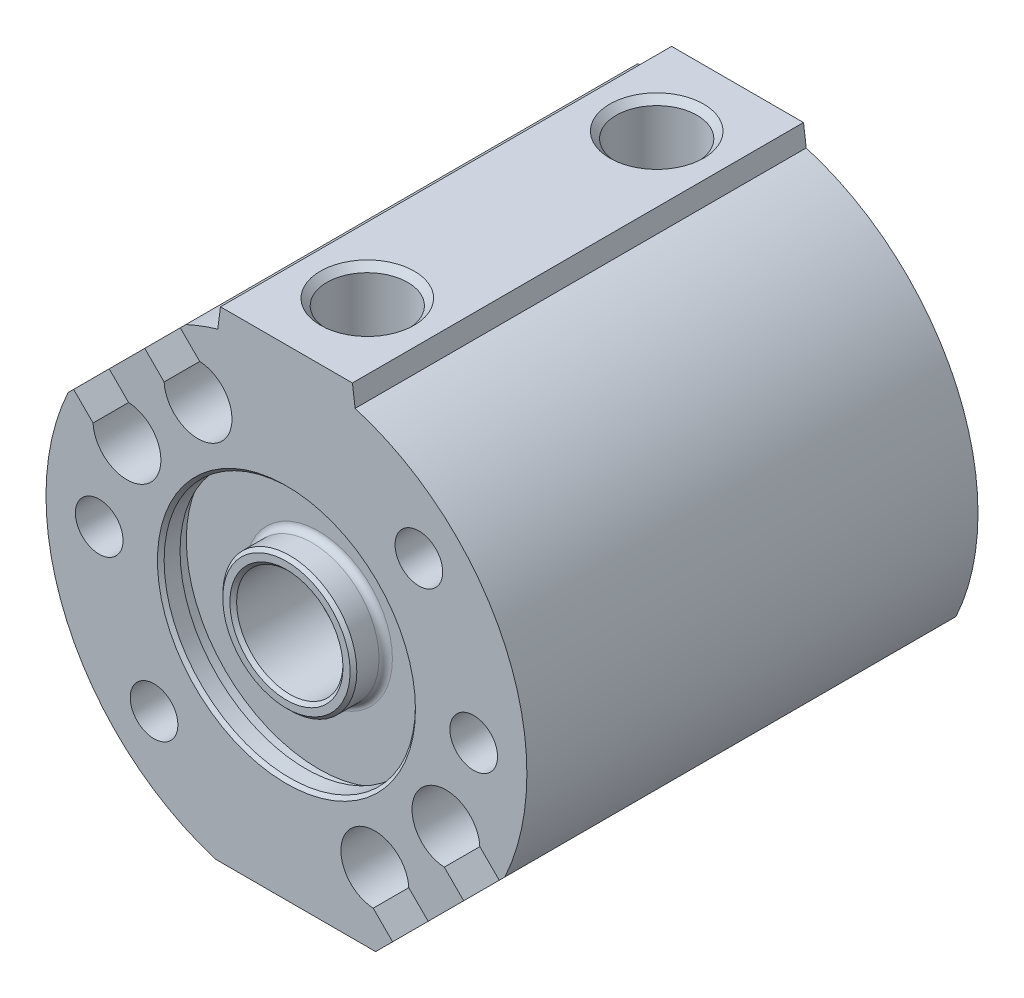
from build123d import *

# Parameters (mm, degrees)
EXTRUDE1_DEPTH                       = 13.462
EXTRUDE1_DEPTH_BACK                  = 13.462
SKETCH1_W                            = 28.702
SKETCH1_H                            = 28.702
SKETCH2_R                            = 20.295378834
F_056_BODY_DEPTH                     = 34.716526778
F_056_250_NOSE_CHAMFER_R             = 0.4
F_056_PORT_BOSS_DEPTH                = 26.924
SKETCH4_R                            = 1.13
F_056_MOUNT_THRU_HOLES_DEPTH         = 34.991663287
F_056_10_32_PORTS_AT_2_COUNT         = 2
F_056_10_32_PORTS_AT_2_PITCH         = 17.272
F_056_4_40_A_MOUNT_TAPPED_AT_2_COUNT = 2
F_056_4_40_A_MOUNT_TAPPED_AT_2_PITCH = 20.650555311
F_056_4_40_A_MOUNT_TAPPED_AT_3_COUNT = 2
F_056_4_40_A_MOUNT_TAPPED_AT_3_PITCH = 22.352
F_056_4_40_A_MOUNT_TAPPED_AT_4_COUNT = 2
F_056_4_40_A_MOUNT_TAPPED_AT_4_PITCH = 8.55374008
F_056_250_START                      = -8.85
SKETCH22_R                           = 7.112
F_056_250_STROKE_CHAMBER_DEPTH       = 17.7
SKETCH23_R                           = 3.175
F_056_250_ROD_THRU_BORE_DEPTH        = 25.733718705
SKETCH41_R                           = 7.112
SKETCH41_R_2                         = 6.612
END_PLATE_DEPTH                      = 1
END_PLATE_TAPER                      = 30
F_056_250_COLLAR_CHAMFER_SIZE        = 0.2


with BuildPart() as part:
    # Sketch1 → Extrude1 (new, two sides: drawn at the far end of the back side and taken through both)
    with BuildSketch(Plane.XY.offset(-EXTRUDE1_DEPTH_BACK)):
        Rectangle(SKETCH1_W, SKETCH1_H)
    extrude(amount=EXTRUDE1_DEPTH + EXTRUDE1_DEPTH_BACK)

    # Sketch2 → 056_Body (cut, through all)
    with BuildSketch(Plane.XY.offset(13.462)):
        Circle(SKETCH2_R)
        with BuildLine():
            Line((-4.221675615, -13.716), (5.322142977, -13.716))
            Line((5.322142977, -13.716), (6.337090973, -12.701052004))
            Line((6.337090973, -12.701052004), (5.17770228, -11.54166331))
            ThreePointArc((5.17770228, -11.54166331), (3.844539569, -8.087180256), (7.299022623, -9.420342967))
            Line((7.299022623, -9.420342967), (8.458411317, -10.57973166))
            Line((8.458411317, -10.57973166), (10.57973166, -8.458411317))
            Line((10.57973166, -8.458411317), (9.420342967, -7.299022623))
            ThreePointArc((9.420342967, -7.299022623), (8.087180256, -3.844539569), (11.54166331, -5.17770228))
            Line((11.54166331, -5.17770228), (12.701052004, -6.337090973))
            Line((12.701052004, -6.337090973), (13.035160011, -6.002982966))
            ThreePointArc((13.035160011, -6.002982966), (10.147689417, 10.147689417), (-6.002982966, 13.035160011))
            Line((-6.002982966, 13.035160011), (-6.337090973, 12.701052004))
            Line((-6.337090973, 12.701052004), (-5.17770228, 11.54166331))
            ThreePointArc((-5.17770228, 11.54166331), (-3.844539569, 8.087180256), (-7.299022623, 9.420342967))
            Line((-7.299022623, 9.420342967), (-8.458411317, 10.57973166))
            Line((-8.458411317, 10.57973166), (-10.57973166, 8.458411317))
            Line((-10.57973166, 8.458411317), (-9.420342967, 7.299022623))
            ThreePointArc((-9.420342967, 7.299022623), (-8.087180256, 3.844539569), (-11.54166331, 5.17770228))
            Line((-11.54166331, 5.17770228), (-12.701052004, 6.337090973))
            Line((-12.701052004, 6.337090973), (-13.035160011, 6.002982966))
            ThreePointArc((-13.035160011, 6.002982966), (-13.10187644, -5.855940125), (-4.221675615, -13.716))
        make_face(mode=Mode.SUBTRACT)
    extrude(amount=-F_056_BODY_DEPTH, mode=Mode.SUBTRACT)

    # Sketch33 → 056-250 Front Recess (revolve, cut)
    with BuildSketch(Plane(origin=(0, 0, 0), x_dir=(0, 0, -1), z_dir=(1, 0, 0)), mode=Mode.PRIVATE) as f_056_250_front_recess_sk:
        Polygon((-13.462, 7.5), (-12.312, 7.5), (-12.312, 7.9), (-11.537, 7.9), (-11.537, 4), (-13.462, 4), align=None)
    revolve(f_056_250_front_recess_sk.sketch.rotate(Axis((0, 0, 61.220394237), (0, 0, -1)), 90), axis=Axis((0, 0, 61.220394237), (0, 0, -1)), mode=Mode.SUBTRACT)

    # 056-250 Nose Chamfer
    f_056_250_nose_chamfer_edges = [part.edges().sort_by_distance(p)[0] for p in [
        (-4, 0, 11.537),
    ]]
    fillet(f_056_250_nose_chamfer_edges, radius=F_056_250_NOSE_CHAMFER_R)

    # Sketch3 → 056_Port Boss (add)
    with BuildSketch(Plane.XY.offset(13.462)):
        with BuildLine():
            Line((-3.937, 14.986), (3.937, 14.986))
            Line((3.937, 14.986), (4.099319032, 13.753064549))
            ThreePointArc((4.099319032, 13.753064549), (0, 14.351), (-4.099319032, 13.753064549))
            Line((-4.099319032, 13.753064549), (-3.937, 14.986))
        make_face()
    extrude(amount=-F_056_PORT_BOSS_DEPTH)

    # Sketch4 → 056_Mount Thru Holes (cut, through all)
    with BuildSketch(Plane.XY.offset(13.462)):
        with Locations((7.902625387, 7.902625387)):
            Circle(SKETCH4_R)
        with Locations((11.176, 0)):
            Circle(SKETCH4_R)
        with Locations((-7.902625387, -7.902625387)):
            Circle(SKETCH4_R)
        with Locations((-11.176, 0)):
            Circle(SKETCH4_R)
    extrude(amount=-F_056_MOUNT_THRU_HOLES_DEPTH, mode=Mode.SUBTRACT)

    # Sketch12 → 056 #10-32 Ports (revolve, cut)
    with BuildSketch(Plane(origin=(0, 14.986, -8.636), x_dir=(0, 0, 1), z_dir=(1, 0, 0))):
        Polygon((0, 0), (0, 7.213317848), (2.0193, 6), (2.0193, 4), (2.413, 4), (2.413, 0.3869944), (2.7999944, 0), align=None)
    f_056_10_32_ports = revolve(axis=Axis((0, 21.336, -8.636), (0, -1, 0)), mode=Mode.SUBTRACT)

    # 056 #10-32 Ports at 2: 056 #10-32 Ports ×2
    with Locations(*[(0, 0, i * F_056_10_32_PORTS_AT_2_PITCH) for i in range(1, F_056_10_32_PORTS_AT_2_COUNT)]):
        add(f_056_10_32_ports, mode=Mode.SUBTRACT)

    # Sketch32 → 056 #4-40 A Mount Tapped (revolve, cut)
    with BuildSketch(Plane(origin=(7.902625387, 7.902625387, 13.462), x_dir=(0, -1, 0), z_dir=(1, 0, 0))):
        Polygon((0, 0), (0, 11.224152758), (1.1303, 10.545), (1.1303, 8.64), (1.4224, 8.64), (1.4224, 0), align=None)
    f_056_4_40_a_mount_tapped = revolve(axis=Axis((7.902625387, 7.902625387, 19.812), (0, 0, -1)), mode=Mode.SUBTRACT)

    # 056 #4-40 A Mount Tapped at 2: 056 #4-40 A Mount Tapped ×2
    with Locations(*[Vector(-0.9238795325112864, -0.38268343236509095, 0) * (i * F_056_4_40_A_MOUNT_TAPPED_AT_2_PITCH) for i in range(1, F_056_4_40_A_MOUNT_TAPPED_AT_2_COUNT)]):
        add(f_056_4_40_a_mount_tapped, mode=Mode.SUBTRACT)

    # 056 #4-40 A Mount Tapped at 3: 056 #4-40 A Mount Tapped ×2
    with Locations(*[Vector(-0.7071067811865461, -0.707106781186549, 0) * (i * F_056_4_40_A_MOUNT_TAPPED_AT_3_PITCH) for i in range(1, F_056_4_40_A_MOUNT_TAPPED_AT_3_COUNT)]):
        add(f_056_4_40_a_mount_tapped, mode=Mode.SUBTRACT)

    # 056 #4-40 A Mount Tapped at 4: 056 #4-40 A Mount Tapped ×2
    with Locations(*[Vector(0.38268343236509034, -0.9238795325112865, 0) * (i * F_056_4_40_A_MOUNT_TAPPED_AT_4_PITCH) for i in range(1, F_056_4_40_A_MOUNT_TAPPED_AT_4_COUNT)]):
        add(f_056_4_40_a_mount_tapped, mode=Mode.SUBTRACT)

    # 056 4-40 A Mount Tapped to Rear: 056 #4-40 A Mount Tapped across plane
    add(f_056_4_40_a_mount_tapped.mirror(Plane.XY), mode=Mode.SUBTRACT)

    # 056 4-40 A Mount Tapped to Rear copy 1 s → 056 4-40 A Mount Tapped to Rear copy 1 (revolve, cut)
    with BuildSketch(Plane(origin=(-11.176, 0, -13.462), x_dir=(0, -1, 0), z_dir=(1, 0, 0))):
        Polygon((0, 0), (0, -11.224152758), (1.1303, -10.545), (1.1303, -8.64), (1.4224, -8.64), (1.4224, 0), align=None)
    revolve(axis=Axis((-11.176, 0, -19.812), (0, 0, -1)), mode=Mode.SUBTRACT)

    # 056 4-40 A Mount Tapped to Rear copy 2 s → 056 4-40 A Mount Tapped to Rear copy 2 (revolve, cut)
    with BuildSketch(Plane(origin=(-7.902625387, -7.902625387, -13.462), x_dir=(0, -1, 0), z_dir=(1, 0, 0))):
        Polygon((0, 0), (0, -11.224152758), (1.1303, -10.545), (1.1303, -8.64), (1.4224, -8.64), (1.4224, 0), align=None)
    revolve(axis=Axis((-7.902625387, -7.902625387, -19.812), (0, 0, -1)), mode=Mode.SUBTRACT)

    # 056 4-40 A Mount Tapped to Rear copy 3 s → 056 4-40 A Mount Tapped to Rear copy 3 (revolve, cut)
    with BuildSketch(Plane(origin=(11.176, 0, -13.462), x_dir=(0, -1, 0), z_dir=(1, 0, 0))):
        Polygon((0, 0), (0, -11.224152758), (1.1303, -10.545), (1.1303, -8.64), (1.4224, -8.64), (1.4224, 0), align=None)
    revolve(axis=Axis((11.176, 0, -19.812), (0, 0, -1)), mode=Mode.SUBTRACT)

    # Sketch22 → 056-250 Stroke Chamber (cut)
    with BuildSketch(Plane.XY.offset(F_056_250_START)):
        Circle(SKETCH22_R)
    extrude(amount=F_056_250_STROKE_CHAMBER_DEPTH, mode=Mode.SUBTRACT)

    # Sketch23 → 056-250 Rod Thru Bore (cut, through all)
    with BuildSketch(Plane.XY):
        with Locations(Location((0, 0, 0), (0, 0, 180))):
            Circle(SKETCH23_R)
    extrude(amount=F_056_250_ROD_THRU_BORE_DEPTH, mode=Mode.SUBTRACT)

    # Sketch41 → End Plate (cut)
    with BuildSketch(Plane(origin=(0, 0, -13.462), x_dir=(-1, 0, 0), z_dir=(0, 0, -1))):
        with Locations(Location((0, 0, 0), (0, 0, 180))):
            Circle(SKETCH41_R)
        Circle(SKETCH41_R_2, mode=Mode.SUBTRACT)
    extrude(amount=-END_PLATE_DEPTH, taper=END_PLATE_TAPER, mode=Mode.SUBTRACT)

    # 056-250 Collar Chamfer
    f_056_250_collar_chamfer_edges = [part.edges().sort_by_distance(p)[0] for p in [
        (-7.5, 0, 13.462),
        (-4, 0, 13.462),
        (3.175, 0, 13.462),
    ]]
    chamfer(f_056_250_collar_chamfer_edges, length=F_056_250_COLLAR_CHAMFER_SIZE)


solid = part.part
